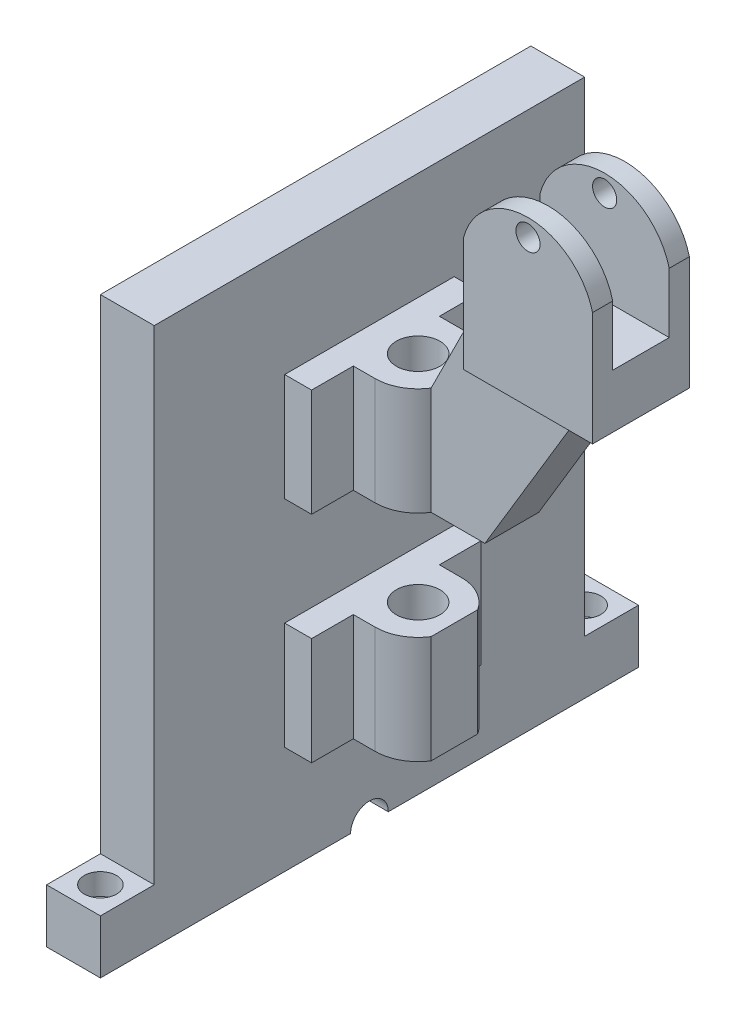
from build123d import *

# Parameters (mm, degrees)
SKETCH1_W               = 10
SKETCH1_H               = 10
BOSS_EXTRUDE1_DEPTH     = 5
SKETCH4_R               = 3
CUT_EXTRUDE1_DEPTH      = 4
SKETCH5_R               = 4.05
BOSS_EXTRUDE2_DEPTH     = 30
CUT_EXTRUDE2_DEPTH      = 106.032848815
CUT_EXTRUDE2_DEPTH_BACK = 106.032848815
SKETCH6_W               = 26.365617629
SKETCH6_H               = 20
SKETCH8_W               = 10
SKETCH8_H               = 8.643528748
BOSS_EXTRUDE3_DEPTH     = 40
SKETCH9_R               = 2.5
BOSS_EXTRUDE4_DEPTH     = 10
CUT_EXTRUDE3_DEPTH      = 99.974452188
CUT_EXTRUDE3_DEPTH_BACK = 99.974452188
CUT_EXTRUDE5_DEPTH      = 99.974452188
CUT_EXTRUDE5_DEPTH_BACK = 99.974452188
SKETCH13_W              = 27.262735852
SKETCH13_H              = 14.70463532
SKETCH14_W              = 24
SKETCH14_H              = 18
BOSS_EXTRUDE5_DEPTH     = 10
SKETCH15_R              = 2.246907778
BOSS_EXTRUDE6_DEPTH     = 9
SKETCH16_W              = 26.867537366
SKETCH16_H              = 22.487326792
CUT_EXTRUDE6_DEPTH      = 5.25


with BuildPart() as part:
    # Sketch1 → Boss-Extrude1 (new, symmetric)
    with BuildSketch(Plane(origin=(0, 0, 0), x_dir=(0, 0, -1), z_dir=(1, 0, 0))):
        with BuildLine():
            Line((-40, -40), (-40, -50))
            Line((-40, -50), (-3.5, -50))
            ThreePointArc((-3.5, -50), (0, -46.5), (3.5, -50))
            Line((3.5, -50), (40, -50))
            Line((40, -50), (40, -40))
            Line((40, -40), (40, 50))
            Line((40, 50), (-40, 50))
            Line((-40, 50), (-40, -40))
        make_face()
        with Locations((-45, -45)):
            Rectangle(SKETCH1_W, SKETCH1_H)
        with Locations((45, -45)):
            Rectangle(SKETCH1_W, SKETCH1_H)
    extrude(amount=BOSS_EXTRUDE1_DEPTH, both=True)

    # Sketch4 → Cut-Extrude1 (cut)
    with BuildSketch(Plane(origin=(0, -40, 0), x_dir=(1, 0, 0), z_dir=(0, 1, 0))):
        with Locations(Location((0, -45, 0), (0, 0, 270))):
            Circle(SKETCH4_R)
    cut_extrude1 = extrude(amount=-CUT_EXTRUDE1_DEPTH, mode=Mode.SUBTRACT)

    # Mirror1: Cut-Extrude1 across plane
    add(cut_extrude1.mirror(Plane.XY), mode=Mode.SUBTRACT)

    # Sketch5 → Boss-Extrude2 (add, symmetric)
    with BuildSketch(Plane(origin=(0, 0, 0), x_dir=(1, 0, 0), z_dir=(0, 1, 0))):
        with BuildLine():
            Line((5, 15.751709746), (5, -15.751709746))
            Line((5, -15.751709746), (10, -15.751709746))
            Line((10, -15.751709746), (10, -8))
            Line((10, -8), (14.05, -8))
            ThreePointArc((14.05, -8), (17.885745365, -7.020474165), (20.782187809, -4.321764374))
            Line((20.782187809, -4.321764374), (20.782187809, 4.321764374))
            ThreePointArc((20.782187809, 4.321764374), (17.885745365, 7.020474165), (14.05, 8))
            Line((14.05, 8), (10, 8))
            Line((10, 8), (10, 15.751709746))
            Line((10, 15.751709746), (5, 15.751709746))
        make_face()
        with Locations(Location((14.05, 0, 0), (0, 0, 270))):
            Circle(SKETCH5_R, mode=Mode.SUBTRACT)
    extrude(amount=BOSS_EXTRUDE2_DEPTH, both=True)

    # Sketch6 → Cut-Extrude2 (cut, two sides: drawn at the far end of the back side and taken through both)
    with BuildSketch(Plane.XY.offset(40).offset(-CUT_EXTRUDE2_DEPTH_BACK)):
        with Locations((18.182808814, 0)):
            Rectangle(SKETCH6_W, SKETCH6_H)
    extrude(amount=CUT_EXTRUDE2_DEPTH + CUT_EXTRUDE2_DEPTH_BACK, mode=Mode.SUBTRACT)

    # Sketch8 → Boss-Extrude3 (add)
    with BuildSketch(Plane.XZ.offset(-10)):
        with Locations((25.782187809, 0)):
            Rectangle(SKETCH8_W, SKETCH8_H)
    extrude(amount=-BOSS_EXTRUDE3_DEPTH)

    # Sketch9 → Boss-Extrude4 (add)
    with BuildSketch(Plane.XY.offset(4.321764374)):
        with BuildLine():
            Line((30.782187809, 10), (54.782187809, 50))
            ThreePointArc((54.782187809, 50), (42.782187809, 62), (30.782187809, 50))
            Line((30.782187809, 50), (30.782187809, 10))
        make_face()
        with Locations((42.782187809, 57.067437711)):
            Circle(SKETCH9_R, mode=Mode.SUBTRACT)
    extrude(amount=-BOSS_EXTRUDE4_DEPTH)

    # Sketch10 → Cut-Extrude3 (cut, two sides: drawn at the far end of the back side and taken through both)
    with BuildSketch(Plane.XY.offset(4.321764374).offset(-CUT_EXTRUDE3_DEPTH_BACK)):
        Polygon((30.782187809, 50), (20.782187809, 30), (20.782187809, 50), align=None)
    extrude(amount=CUT_EXTRUDE3_DEPTH + CUT_EXTRUDE3_DEPTH_BACK, mode=Mode.SUBTRACT)

    # Sketch13 → Cut-Extrude5 (cut, two sides: drawn at the far end of the back side and taken through both)
    with BuildSketch(Plane.XY.offset(4.321764374).offset(-CUT_EXTRUDE5_DEPTH_BACK)):
        with Locations((44.413555735, 57.35231766)):
            Rectangle(SKETCH13_W, SKETCH13_H)
    extrude(amount=CUT_EXTRUDE5_DEPTH + CUT_EXTRUDE5_DEPTH_BACK, mode=Mode.SUBTRACT)

    # Sketch14 → Boss-Extrude5 (add)
    with BuildSketch(Plane(origin=(0, 50, 0), x_dir=(1, 0, 0), z_dir=(0, 1, 0))):
        with Locations((42.782187809, 0.678235626)):
            Rectangle(SKETCH14_W, SKETCH14_H)
    extrude(amount=-BOSS_EXTRUDE5_DEPTH)

    # Sketch15 → Boss-Extrude6 (add, symmetric)
    with BuildSketch(Plane.XY.offset(-0.678235626)):
        with BuildLine():
            Line((30.782187809, 50), (54.782187809, 50))
            Line((54.782187809, 50), (54.782187809, 61.15))
            ThreePointArc((54.782187809, 61.15), (42.783764567, 70.463225851), (30.782187809, 61.15406416))
            Line((30.782187809, 61.15406416), (30.782187809, 50))
        make_face()
        with Locations((42.782187809, 67.246907778)):
            Circle(SKETCH15_R, mode=Mode.SUBTRACT)
    extrude(amount=BOSS_EXTRUDE6_DEPTH, both=True)

    # Sketch16 → Cut-Extrude6 (cut, symmetric)
    with BuildSketch(Plane.XY.offset(-0.678235626)):
        with Locations((44.215956492, 61.243663396)):
            Rectangle(SKETCH16_W, SKETCH16_H)
    extrude(amount=CUT_EXTRUDE6_DEPTH, both=True, mode=Mode.SUBTRACT)


solid = part.part
